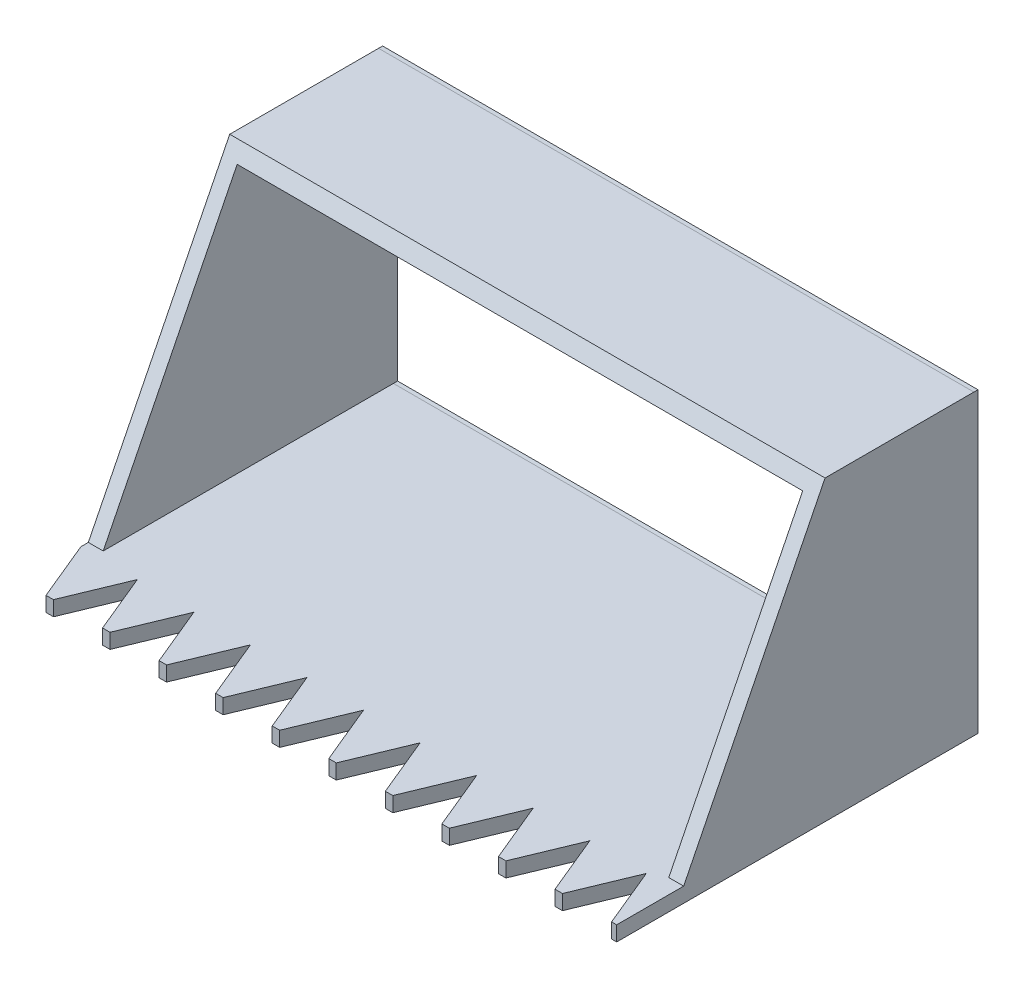
from build123d import *

# Parameters (mm, degrees)
SKETCH1_W               = 101.6
SKETCH1_H               = 50.8
BOSS_EXTRUDE1_DEPTH     = 50.8
BOSS_EXTRUDE2_DEPTH     = 101.6
CUT_EXTRUDE1_DEPTH      = 101.6
SHELL1_T                = -2.54
SKETCH4_W               = 101.6
SKETCH4_H               = 2.54
BOSS_EXTRUDE3_DEPTH     = 12.7
CUT_EXTRUDE2_DEPTH      = 2.54
LPATTERN1_COUNT         = 11
LPATTERN1_PITCH         = 9.652
CUT_EXTRUDE3_DEPTH      = 109.22
CUT_EXTRUDE3_DEPTH_BACK = 5.08
SKETCH6_W               = 39.172348931
SKETCH6_H               = 64.321849683


with BuildPart() as part:
    # Sketch1 → Boss-Extrude1 (new body)
    with BuildSketch(Plane.XY):
        with Locations((50.8, 25.4)):
            Rectangle(SKETCH1_W, SKETCH1_H)
    extrude(amount=-BOSS_EXTRUDE1_DEPTH)

    # Sketch2 → Boss-Extrude2 (add)
    with BuildSketch(Plane.ZY):
        with BuildLine():
            Line((-50.8, 50.8), (-50.8, 0))
            ThreePointArc((-50.8, 0), (-76.2, 25.4), (-50.8, 50.8))
        make_face()
    extrude(amount=-BOSS_EXTRUDE2_DEPTH)

    # Sketch3 → Cut-Extrude1 (cut)
    with BuildSketch(Plane.ZY):
        Polygon((0, 0), (-25.4, 50.8), (0, 50.8), align=None)
    extrude(amount=-CUT_EXTRUDE1_DEPTH, mode=Mode.SUBTRACT)

    # Shell1
    shell1_openings = [part.faces().sort_by_distance(p)[0] for p in [
        (50.8, 25.4, -12.7),
    ]]
    offset(amount=SHELL1_T, openings=shell1_openings, kind=Kind.INTERSECTION)

    # Sketch4 → Boss-Extrude3 (add)
    with BuildSketch(Plane.XY.offset(-2.54)):
        with Locations((50.8, 1.27)):
            Rectangle(SKETCH4_W, SKETCH4_H)
    extrude(amount=BOSS_EXTRUDE3_DEPTH)

    # Sketch5 → Cut-Extrude2 (cut)
    with BuildSketch(Plane(origin=(0, 2.54, 0), x_dir=(1, 0, 0), z_dir=(0, 1, 0))):
        Polygon((0, 0), (4.208409794, -10.16), (0, -10.16), align=None)
        Polygon((5.478409794, -10.16), (9.686819587, 0), (9.686819587, -10.16), align=None)
    cut_extrude2 = extrude(amount=-CUT_EXTRUDE2_DEPTH, mode=Mode.SUBTRACT)

    # LPattern1: Cut-Extrude2 ×11
    with Locations(*[(i * LPATTERN1_PITCH, 0, 0) for i in range(1, LPATTERN1_COUNT)]):
        add(cut_extrude2, mode=Mode.SUBTRACT)

    # Sketch6 → Cut-Extrude3 (cut, two sides: drawn at the far end of the back side and taken through both)
    with BuildSketch(Plane.ZY.offset(-99.06).offset(-CUT_EXTRUDE3_DEPTH_BACK)):
        with Locations((-71.087050569, 22.645845649)):
            Rectangle(SKETCH6_W, SKETCH6_H)
    extrude(amount=CUT_EXTRUDE3_DEPTH + CUT_EXTRUDE3_DEPTH_BACK, mode=Mode.SUBTRACT)


solid = part.part
